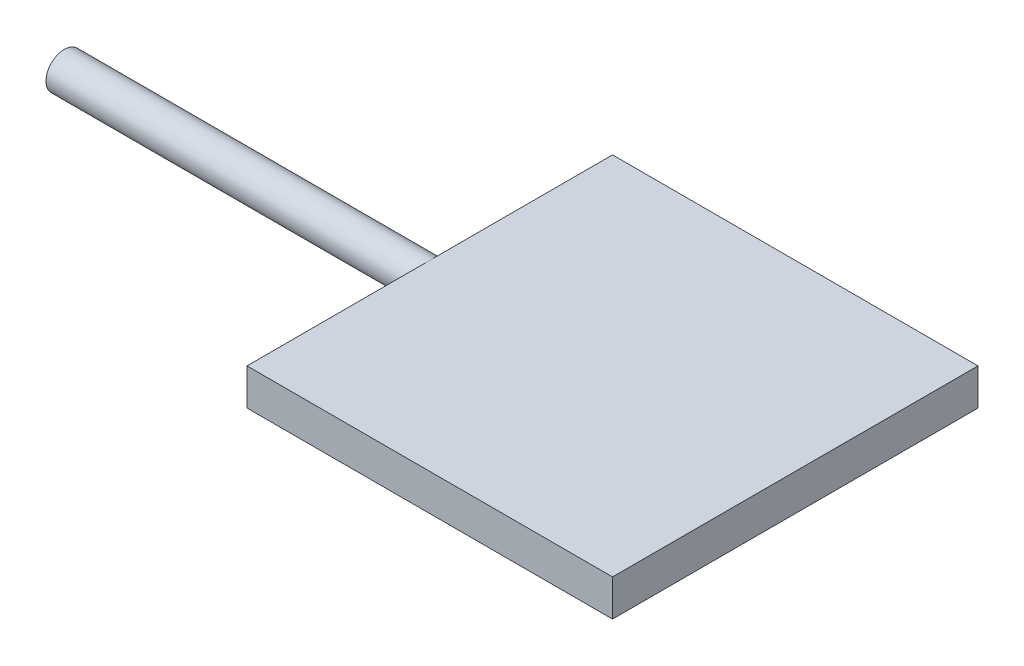
from build123d import *

# Parameters (mm, degrees)
CROQUIS1_W              = 100
CROQUIS1_H              = 100
SALIENTE_EXTRUIR1_DEPTH = 10
CROQUIS2_R              = 5
SALIENTE_EXTRUIR2_DEPTH = 100


with BuildPart() as part:
    # Croquis1 → Saliente-Extruir1 (new body)
    with BuildSketch(Plane(origin=(0, 0, 0), x_dir=(1, 0, 0), z_dir=(0, 1, 0))):
        with Locations((50, 50)):
            Rectangle(CROQUIS1_W, CROQUIS1_H)
    extrude(amount=SALIENTE_EXTRUIR1_DEPTH)

    # Croquis2 → Saliente-Extruir2 (add)
    with BuildSketch(Plane.ZY):
        with Locations(Location((-50, 5, 0), (0, 0, 270))):
            Circle(CROQUIS2_R)
    extrude(amount=SALIENTE_EXTRUIR2_DEPTH)


solid = part.part
